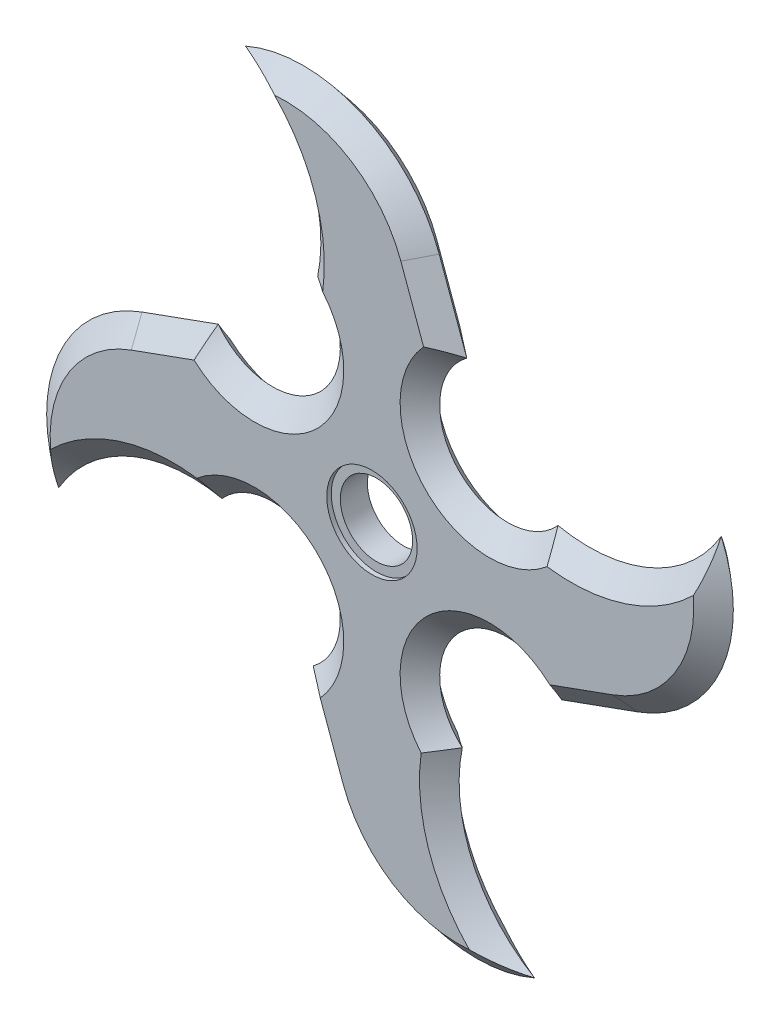
from build123d import *

# Parameters (mm, degrees)
BOSS_EXTRUDE1_DEPTH = 2
BOSS_EXTRUDE1_TAPER = 50
SKETCH2_R           = 5
CUT_EXTRUDE1_DEPTH  = 0.5
SKETCH4_R           = 4
CUT_EXTRUDE2_DEPTH  = 54.772179322


with BuildPart() as part:
    # Sketch1 → Boss-Extrude1 (new body)
    with BuildSketch(Plane.XY):
        with BuildLine():
            Line((8.5, 19), (5.445025952, 27.441287035))
            ThreePointArc((5.445025952, 27.441287035), (-3.280737627, 36.695578385), (-16, 36.66060556))
            ThreePointArc((-16, 36.66060556), (-9.104527974, 28.907248173), (-8, 18.590169944))
            ThreePointArc((-8, 18.590169944), (-5.502905317, 13.208737444), (-7.696699141, 7.696699141))
            ThreePointArc((-7.696699141, 7.696699141), (-13.531667651, 5.518868434), (-19, 8.5))
            Line((-19, 8.5), (-27.441287035, 5.445025952))
            ThreePointArc((-27.441287035, 5.445025952), (-36.695578385, -3.280737627), (-36.66060556, -16))
            ThreePointArc((-36.66060556, -16), (-28.907248173, -9.104527974), (-18.590169944, -8))
            ThreePointArc((-18.590169944, -8), (-13.208737444, -5.502905317), (-7.696699141, -7.696699141))
            ThreePointArc((-7.696699141, -7.696699141), (-5.518868434, -13.531667651), (-8.5, -19))
            Line((-8.5, -19), (-5.445025952, -27.441287035))
            ThreePointArc((-5.445025952, -27.441287035), (3.280737627, -36.695578385), (16, -36.66060556))
            ThreePointArc((16, -36.66060556), (9.104527974, -28.907248173), (8, -18.590169944))
            ThreePointArc((8, -18.590169944), (5.502905317, -13.208737444), (7.696699141, -7.696699141))
            ThreePointArc((7.696699141, -7.696699141), (13.531667651, -5.518868434), (19, -8.5))
            Line((19, -8.5), (27.441287035, -5.445025952))
            ThreePointArc((27.441287035, -5.445025952), (36.695578385, 3.280737627), (36.66060556, 16))
            ThreePointArc((36.66060556, 16), (28.907248173, 9.104527974), (18.590169944, 8))
            ThreePointArc((18.590169944, 8), (13.208737444, 5.502905317), (7.696699141, 7.696699141))
            ThreePointArc((7.696699141, 7.696699141), (5.518868434, 13.531667651), (8.5, 19))
        make_face()
    boss_extrude1 = extrude(amount=BOSS_EXTRUDE1_DEPTH, taper=BOSS_EXTRUDE1_TAPER)

    # Sketch2 → Cut-Extrude1 (cut)
    with BuildSketch(Plane.XY.offset(2)):
        Circle(SKETCH2_R)
    cut_extrude1 = extrude(amount=-CUT_EXTRUDE1_DEPTH, mode=Mode.SUBTRACT)

    # Sketch4 → Cut-Extrude2 (cut, through all)
    with BuildSketch(Plane.XY.offset(2)):
        Circle(SKETCH4_R)
    cut_extrude2 = extrude(amount=-CUT_EXTRUDE2_DEPTH, mode=Mode.SUBTRACT)


with BuildPart() as mirror4_1:
    # Mirror4: Boss-Extrude1 across Front Plane
    add(boss_extrude1.mirror(Plane.XY))

    # Mirror4 2: Cut-Extrude1, Cut-Extrude2 across Front Plane
    add(cut_extrude1.mirror(Plane.XY), mode=Mode.SUBTRACT)
    add(cut_extrude2.mirror(Plane.XY), mode=Mode.SUBTRACT)


with BuildPart() as part_1:
    add(part.part)

    # Mirror4 united with what the copies touc: union Mirror4_1
    add(mirror4_1.part)


solid = part_1.part
